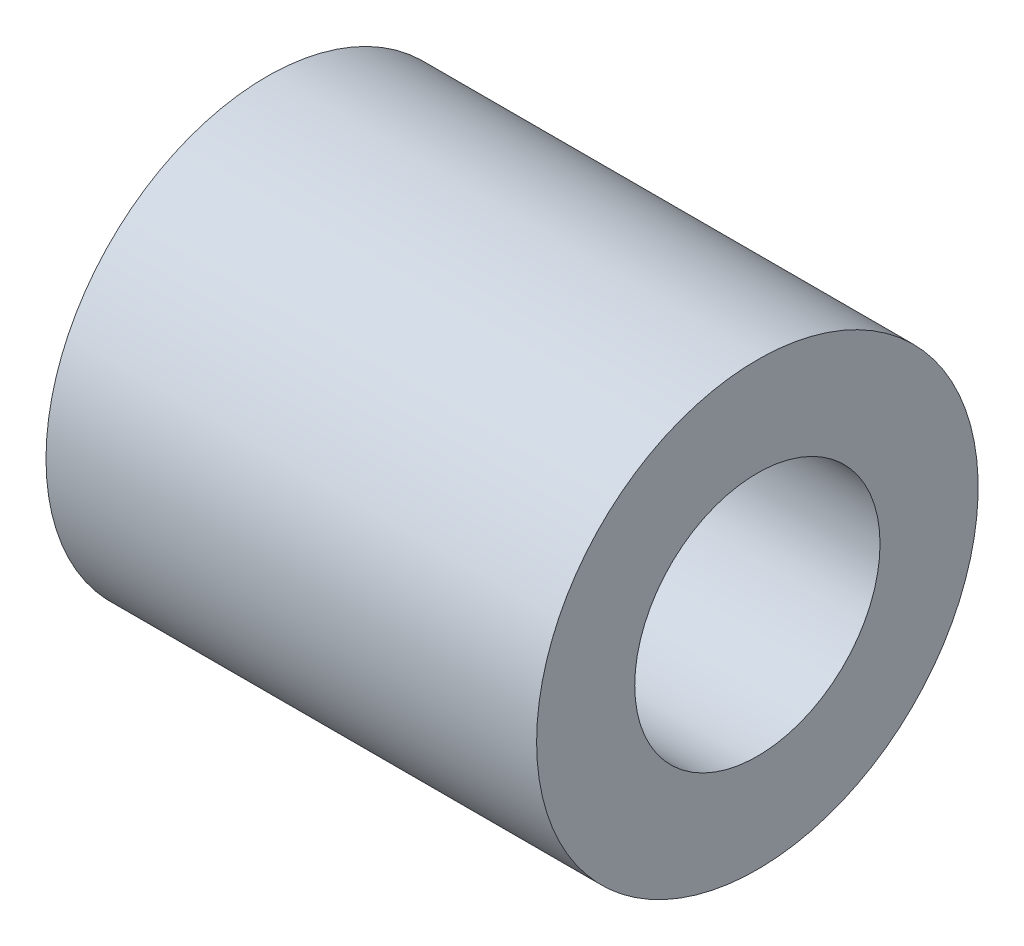
from build123d import *

# Parameters (mm, degrees)
SKETCH_1_W = 150
SKETCH_1_H = 30


with BuildPart() as part:
    # Эскиз1 → Повернуть1 (revolve)
    with BuildSketch(Plane.XY, mode=Mode.PRIVATE) as revolve_1_sk:
        with Locations((75, 52.5)):
            Rectangle(SKETCH_1_W, SKETCH_1_H)
    revolve(revolve_1_sk.sketch.rotate(Axis((0, 0, 0), (1, 0, 0)), 90), axis=Axis((0, 0, 0), (1, 0, 0)))


solid = part.part
